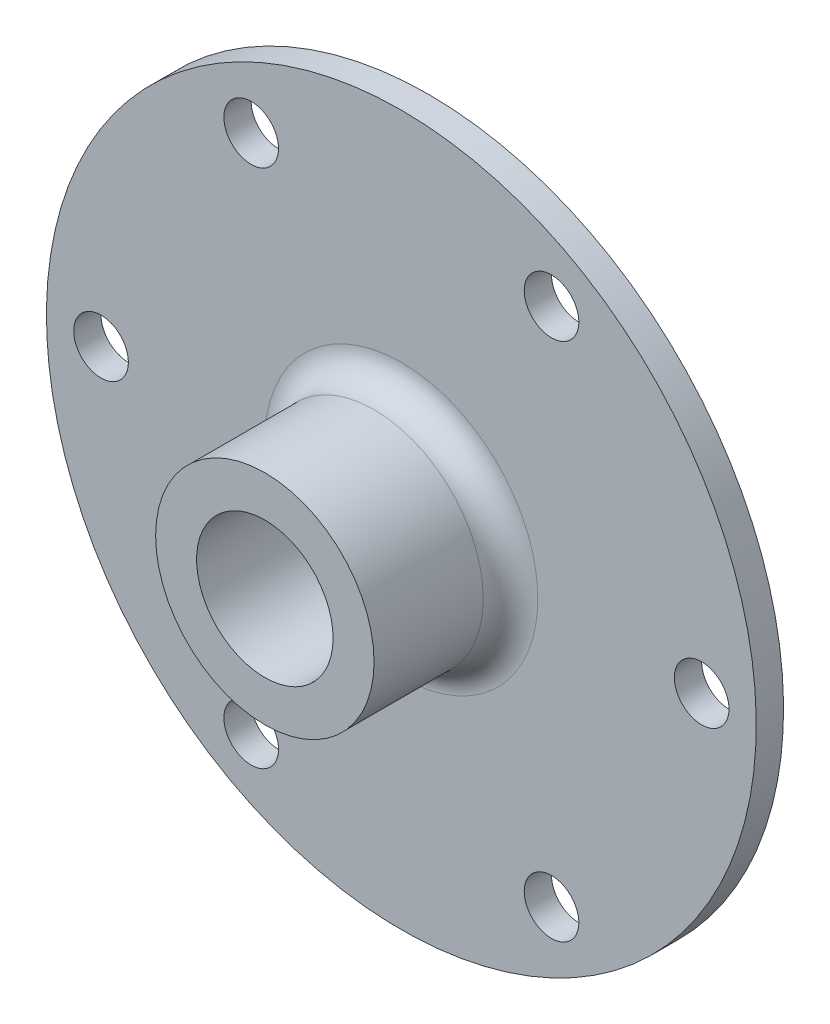
from build123d import *

# Parameters (mm, degrees)
SKETCH2_R          = 7.9375
CUT_EXTRUDE1_DEPTH = 62.401577748
SKETCH3_R          = 3.175
CUT_EXTRUDE2_DEPTH = 61.491874454
CIRPATTERN4_COUNT  = 6
FILLET1_R          = 3.175


with BuildPart() as part:
    # Sketch1 → Flange Base (revolve)
    with BuildSketch(Plane(origin=(0, 0, 0), x_dir=(0, 0, -1), z_dir=(1, 0, 0))):
        Polygon((0, 0), (0, 41.275), (-3.175, 41.275), (-3.175, 12.7), (-19.05, 12.7), (-19.05, 0), align=None)
    revolve(axis=Axis((0, 0, 0), (0, 0, 1)))

    # Sketch2 → Cut-Extrude1 (cut, through all)
    with BuildSketch(Plane.XY.offset(19.05)):
        Circle(SKETCH2_R)
    extrude(amount=-CUT_EXTRUDE1_DEPTH, mode=Mode.SUBTRACT)

    # Sketch3 → Cut-Extrude2 (cut, through all)
    with BuildSketch(Plane.XY.offset(3.175)):
        with Locations((34.925, 0)):
            Circle(SKETCH3_R)
    cut_extrude2 = extrude(amount=-CUT_EXTRUDE2_DEPTH, mode=Mode.SUBTRACT)

    # CirPattern4: Cut-Extrude2 ×6 about axis
    cirpattern4_axis = Axis((0, 0, 0), (0, 0, 1))
    for i in range(1, CIRPATTERN4_COUNT):
        add(cut_extrude2.rotate(cirpattern4_axis, i * 360 / CIRPATTERN4_COUNT), mode=Mode.SUBTRACT)

    # Fillet1
    fillet1_edges = [part.edges().sort_by_distance(p)[0] for p in [
        (0, -12.7, 3.175),
    ]]
    fillet(fillet1_edges, radius=FILLET1_R)


solid = part.part
